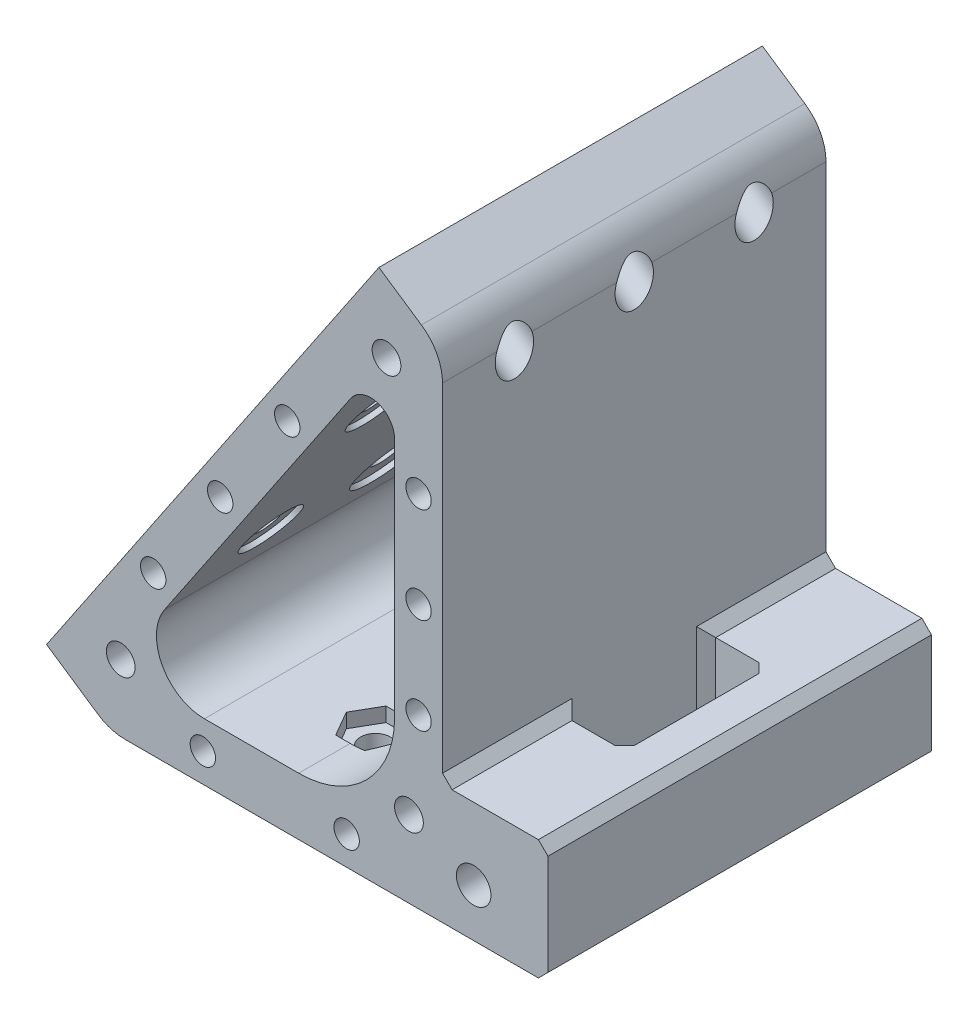
from build123d import *

# Parameters (mm, degrees)
EXTRUDE_1_DEPTH           = 80
SKETCH_2_W                = 80
SKETCH_2_H                = 124
EXTRUDE_2_DEPTH           = 16
FILLET_1_R                = 10
CUT_EXTRUDE_1_DEPTH       = 80
SKETCH_4_R                = 2
SKETCH_4_R_2              = 2.5
SKETCH_4_R_3              = 3
CUT_EXTRUDE_2_DEPTH       = 20
SKETCH_6_R                = 4
CUT_EXTRUDE_3_DEPTH       = 23
SKETCH_12_W               = 22
SKETCH_12_H               = 25
EXTRUDE_3_DEPTH           = 80
CUT_EXTRUDE_12_DEPTH      = 1
CUT_EXTRUDE_12_DEPTH_BACK = 1
SKETCH_17_R               = 6
SKETCH_17_R_2             = 7.5
SKETCH_15_R               = 3
SKETCH_15_R_2             = 2.65
CUT_EXTRUDE_13_DEPTH      = 8
SKETCH_18_W               = 13
SKETCH_18_H               = 30
CUT_EXTRUDE_14_DEPTH      = 25
SKETCH_19_R               = 3.1
SKETCH_19_R_2             = 7.5
CUT_EXTRUDE_15_DEPTH      = 8
CUT_EXTRUDE_16_REACH      = 162.347
SKETCH_20_R               = 3.6
CHAMFER_1_SIZE            = 2
SKETCH_21_R               = 3
CUT_EXTRUDE_17_DEPTH      = 80
CUT_EXTRUDE_18_DEPTH      = 10
CUT_EXTRUDE_18_DEPTH_BACK = 3
SKETCH_23_R               = 3.1
CUT_EXTRUDE_19_DEPTH      = 12


with BuildPart() as part:
    # Эскиз1 → Бобышка-Вытянуть1 (new body)
    with BuildSketch(Plane.XY):
        Polygon((0, 102.800658997), (-69.33992003, 0), (0, 0), align=None)
    extrude(amount=EXTRUDE_1_DEPTH)

    # Эскиз2 → Бобышка-Вытянуть2 (add)
    with BuildSketch(Plane(origin=(-47.65755563, 32.145427165, 0), x_dir=(0, 0, 1), z_dir=(-0.829037572555039, 0.5591929034707509, 0))):
        with Locations((40, 23.225608792)):
            Rectangle(SKETCH_2_W, SKETCH_2_H)
    extrude(amount=EXTRUDE_2_DEPTH)

    # Скругление1
    fillet_1_edges = [part.edges().sort_by_distance(p)[0] for p in [
        (-69.33992003, 0, 40),
        (0, 102.800658997, 40),
    ]]
    fillet(fillet_1_edges, radius=FILLET_1_R)

    # Эскиз3 → Вырез-Вытянуть1 (cut)
    with BuildSketch(Plane.XY.offset(80)):
        with BuildLine():
            Line((-19.145187863, 85.146500636), (-57.966236591, 27.591929035))
            ThreePointArc((-57.966236591, 27.591929035), (-58.505336794, 17.305284372), (-49.675860866, 12))
            Line((-49.675860866, 12), (-30, 12))
            ThreePointArc((-30, 12), (-15.857864376, 17.857864376), (-10, 32))
            Line((-10, 32), (-10, 82.350536119))
            ThreePointArc((-10, 82.350536119), (-13.538141476, 87.132059899), (-19.145187863, 85.146500636))
        make_face()
    extrude(amount=-CUT_EXTRUDE_1_DEPTH, mode=Mode.SUBTRACT)

    # Эскиз4 → Вырез-Вытянуть2 (cut)
    with BuildSketch(Plane(origin=(-60.922156791, 41.09251362, 0), x_dir=(0, 0, 1), z_dir=(-0.8290375725550388, 0.559192903470751, 0))):
        with Locations(Location((40, 79.225608792, 0), (0, 0, 270))):
            Circle(SKETCH_4_R)
        with Locations(Location((15, 79.225608792, 0), (0, 0, 270))):
            Circle(SKETCH_4_R)
        with Locations(Location((65, 79.225608792, 0), (0, 0, 270))):
            Circle(SKETCH_4_R)
        with Locations(Location((15, 43.225608792, 0), (0, 0, 270))):
            Circle(SKETCH_4_R_2)
        with Locations(Location((40, 43.225608792, 0), (0, 0, 270))):
            Circle(SKETCH_4_R_3)
        with Locations(Location((65, 43.225608792, 0), (0, 0, 270))):
            Circle(SKETCH_4_R_2)
        with Locations(Location((65, 3.225608792, 0), (0, 0, 270))):
            Circle(SKETCH_4_R_2)
        with Locations(Location((40, 3.225608792, 0), (0, 0, 270))):
            Circle(SKETCH_4_R_3)
        with Locations(Location((15, 3.225608792, 0), (0, 0, 270))):
            Circle(SKETCH_4_R_2)
        with Locations(Location((65, -32.774391208, 0), (0, 0, 90))):
            Circle(SKETCH_4_R)
        with Locations(Location((15, -32.774391208, 0), (0, 0, 90))):
            Circle(SKETCH_4_R)
        with Locations(Location((40, -32.774391208, 0), (0, 0, 90))):
            Circle(SKETCH_4_R)
    extrude(amount=-CUT_EXTRUDE_2_DEPTH, mode=Mode.SUBTRACT)

    # Эскиз6 → Вырез-Вытянуть3 (cut)
    with BuildSketch(Plane(origin=(-31.905841752, 21.520761999, 0), x_dir=(0, 0, 1), z_dir=(-0.8290375725550388, 0.559192903470751, 0))):
        with Locations(Location((65, -32.774391208, 0), (0, 0, 90))):
            Circle(SKETCH_6_R)
        with Locations(Location((40, -32.774391208, 0), (0, 0, 90))):
            Circle(SKETCH_6_R)
        with Locations(Location((15, -32.774391208, 0), (0, 0, 90))):
            Circle(SKETCH_6_R)
        with Locations(Location((65, 79.225608792, 0), (0, 0, 23.45210018))):
            Circle(SKETCH_6_R)
        with Locations(Location((40, 79.225608792, 0), (0, 0, 23.45210018))):
            Circle(SKETCH_6_R)
        with Locations(Location((15, 79.225608792, 0), (0, 0, 23.45210018))):
            Circle(SKETCH_6_R)
    extrude(amount=CUT_EXTRUDE_3_DEPTH, mode=Mode.SUBTRACT)

    # Эскиз12 → Бобышка-Вытянуть3 (add)
    with BuildSketch(Plane(origin=(0, 0, 0), x_dir=(-1, 0, 0), z_dir=(0, 0, -1))):
        with Locations((-11, 12.5)):
            Rectangle(SKETCH_12_W, SKETCH_12_H)
    extrude(amount=-EXTRUDE_3_DEPTH)

    # Эскиз17 → Вырез-Вытянуть12 (cut, two sides: drawn at the far end of the back side and taken through both)
    with BuildSketch(Plane(origin=(-52.631781066, 35.500584585, 0), x_dir=(0, 0, -1), z_dir=(0.8290375725550388, -0.5591929034707511, 0)).offset(-CUT_EXTRUDE_12_DEPTH_BACK)):
        with Locations(Location((-65, 43.225608792, 0), (0, 0, 270))):
            Circle(SKETCH_17_R)
        with Locations(Location((-40, 43.225608792, 0), (0, 0, 270))):
            Circle(SKETCH_17_R_2)
        with Locations(Location((-15, 43.225608792, 0), (0, 0, 270))):
            Circle(SKETCH_17_R)
        with Locations(Location((-65, 3.225608792, 0), (0, 0, 270))):
            Circle(SKETCH_17_R)
        with Locations(Location((-40, 3.225608792, 0), (0, 0, 270))):
            Circle(SKETCH_17_R_2)
        with Locations(Location((-15, 3.225608792, 0), (0, 0, 270))):
            Circle(SKETCH_17_R)
    extrude(amount=CUT_EXTRUDE_12_DEPTH + CUT_EXTRUDE_12_DEPTH_BACK, mode=Mode.SUBTRACT)

    # Эскиз15 → Вырез-Вытянуть13 (cut)
    with BuildSketch(Plane.XY.offset(80)):
        with Locations((-7, 16)):
            Circle(SKETCH_15_R)
        with Locations((-11.684540277, 96.207365547)):
            Circle(SKETCH_15_R)
        with Locations((-67.134108486, 14)):
            Circle(SKETCH_15_R)
        with Locations((-60.349536408, 33)):
            Circle(SKETCH_15_R_2)
        with Locations((-46.369713821, 53.725939314)):
            Circle(SKETCH_15_R_2)
        with Locations((-32.389891235, 74.451878628)):
            Circle(SKETCH_15_R_2)
        with Locations((-50, 6)):
            Circle(SKETCH_15_R_2)
        with Locations((-20, 6)):
            Circle(SKETCH_15_R_2)
        with Locations((-5, 75)):
            Circle(SKETCH_15_R_2)
        with Locations((-5, 55)):
            Circle(SKETCH_15_R_2)
        with Locations((-5, 35)):
            Circle(SKETCH_15_R_2)
    cut_extrude_13 = extrude(amount=-CUT_EXTRUDE_13_DEPTH, mode=Mode.SUBTRACT)

    # Зеркальное отражение1: Вырез-Вытянуть13 across plane
    add(cut_extrude_13.mirror(Plane(origin=(0, 0, 40), x_dir=(1, 0, 0), z_dir=(0, 0, -1))), mode=Mode.SUBTRACT)

    # Эскиз18 → Вырез-Вытянуть14 (cut)
    with BuildSketch(Plane.XZ):
        with Locations((6.5, 40)):
            Rectangle(SKETCH_18_W, SKETCH_18_H)
    extrude(amount=-CUT_EXTRUDE_14_DEPTH, mode=Mode.SUBTRACT)

    # Эскиз19 → Вырез-Вытянуть15 (cut)
    with BuildSketch(Plane.XZ):
        with Locations(Location((-30, 64, 0), (0, 0, 270))):
            Circle(SKETCH_19_R)
        with Locations(Location((-9.215390309, 52, 0), (0, 0, 270))):
            Circle(SKETCH_19_R)
        with Locations(Location((-9.215390309, 28, 0), (0, 0, 270))):
            Circle(SKETCH_19_R)
        with Locations(Location((-30, 16, 0), (0, 0, 270))):
            Circle(SKETCH_19_R)
        with Locations(Location((-50.784609691, 28, 0), (0, 0, 270))):
            Circle(SKETCH_19_R)
        with Locations(Location((-50.784609691, 52, 0), (0, 0, 270))):
            Circle(SKETCH_19_R)
        with Locations(Location((-30, 40, 0), (0, 0, 270))):
            Circle(SKETCH_19_R_2)
    extrude(amount=-CUT_EXTRUDE_15_DEPTH, mode=Mode.SUBTRACT)

    # Вырез-Вытянуть16: up to this face of the body (flat: up to its plane)
    cut_extrude_16_end = Plane(part.part.faces().sort_by_distance((-22.141306608, 1.53067516, 0))[0])
    # Эскиз20 → Вырез-Вытянуть16 (cut, up to the picked face)
    with BuildSketch(Plane.XY.offset(80), mode=Mode.PRIVATE) as cut_extrude_16_sk1:
        with Locations((6.5, 10)):
            Circle(SKETCH_20_R)
    cut_extrude_16_tool1 = split(extrude(cut_extrude_16_sk1.sketch, amount=-CUT_EXTRUDE_16_REACH, mode=Mode.PRIVATE), bisect_by=cut_extrude_16_end, keep=Keep.BOTH, mode=Mode.PRIVATE)
    add(cut_extrude_16_tool1.solids().sort_by(Axis((6.5, 10, 80), (0, 0, -1)))[0], mode=Mode.SUBTRACT)

    # Фаска1
    chamfer_1_edges = [part.edges().sort_by_distance(p)[0] for p in [
        (0, 25, 67.5),
        (22, 0, 40),
        (22, 25, 40),
        (0, 25, 12.5),
        (13, 12.5, 25),
        (13, 12.5, 55),
        (0, 12.5, 55),
        (0, 12.5, 25),
    ]]
    chamfer(chamfer_1_edges, length=CHAMFER_1_SIZE)

    # Эскиз21 → Вырез-Вытянуть17 (cut)
    with BuildSketch(Plane.XY.offset(80)):
        with Locations((-11.684540277, 96.207365547)):
            Circle(SKETCH_21_R)
        with Locations((-67.134108486, 14)):
            Circle(SKETCH_21_R)
        with Locations((-7, 16)):
            Circle(SKETCH_21_R)
    extrude(amount=-CUT_EXTRUDE_17_DEPTH, mode=Mode.SUBTRACT)

    # Эскиз22 → Вырез-Вытянуть18 (cut, two sides: drawn at the far end of the back side and taken through both)
    with BuildSketch(Plane(origin=(0, 12, 0), x_dir=(1, 0, 0), z_dir=(0, 1, 0)).offset(-CUT_EXTRUDE_18_DEPTH_BACK)):
        Polygon((-26.968911087, -10.75), (-33.031088913, -10.75), (-36.062177826, -16), (-33.031088913, -21.25), (-26.968911087, -21.25), (-23.937822174, -16), align=None)
        Polygon((-33.031088913, -58.75), (-36.062177826, -64), (-33.031088913, -69.25), (-26.968911087, -69.25), (-23.937822174, -64), (-26.968911087, -58.75), align=None)
    extrude(amount=CUT_EXTRUDE_18_DEPTH + CUT_EXTRUDE_18_DEPTH_BACK, mode=Mode.SUBTRACT)

    # Эскиз23 → Вырез-Вытянуть19 (cut)
    with BuildSketch(Plane.XZ):
        with Locations(Location((-30, 64, 0), (0, 0, 270))):
            Circle(SKETCH_23_R)
        with Locations(Location((-30, 16, 0), (0, 0, 270))):
            Circle(SKETCH_23_R)
    extrude(amount=-CUT_EXTRUDE_19_DEPTH, mode=Mode.SUBTRACT)


solid = part.part
